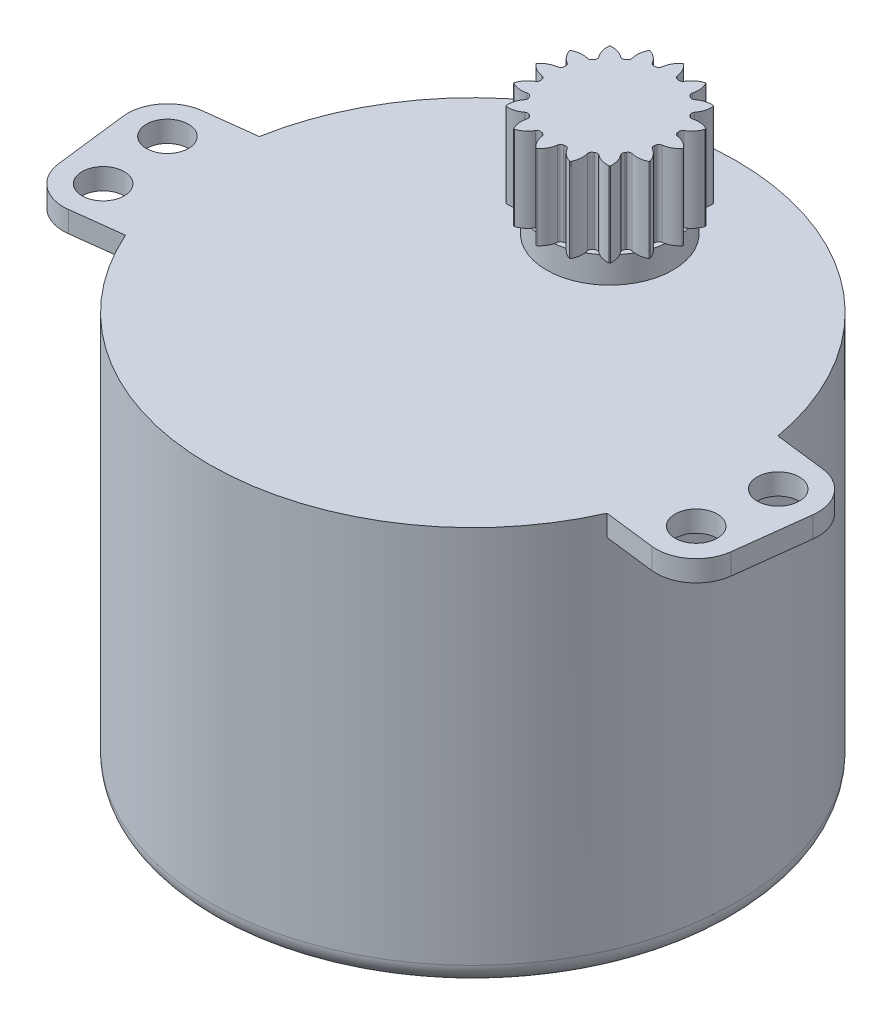
from build123d import *

# Parameters (mm, degrees)
SKETCH1_R           = 25
BOSS_EXTRUDE1_DEPTH = 38
FILLET1_R           = 2
SKETCH2_R           = 6
BOSS_EXTRUDE2_DEPTH = 2.5
SKETCH3_R           = 7
BOSS_EXTRUDE3_DEPTH = 8
CUT_EXTRUDE1_START  = -8
SKETCH4_R           = 7
CUT_EXTRUDE1_DEPTH  = 8
BOSS_EXTRUDE4_START = -2
SKETCH5_R           = 2
BOSS_EXTRUDE4_DEPTH = 2
SKETCH6_W           = 10
SKETCH6_H           = 4
CUT_EXTRUDE2_DEPTH  = 4


with BuildPart() as part:
    # Sketch1 → Boss-Extrude1 (new body)
    with BuildSketch(Plane(origin=(0, 0, 0), x_dir=(1, 0, 0), z_dir=(0, 1, 0))):
        with Locations(Location((0, 0, 0), (0, 0, 270))):
            Circle(SKETCH1_R)
    extrude(amount=BOSS_EXTRUDE1_DEPTH)

    # Fillet1
    fillet1_edges = [part.edges().sort_by_distance(p)[0] for p in [
        (0, 0, -25),
    ]]
    fillet(fillet1_edges, radius=FILLET1_R)

    # Sketch2 → Boss-Extrude2 (add)
    with BuildSketch(Plane(origin=(0, 38, 0), x_dir=(1, 0, 0), z_dir=(0, 1, 0))):
        with Locations(Location((0, 13, 0), (0, 0, 270))):
            Circle(SKETCH2_R)
    extrude(amount=BOSS_EXTRUDE2_DEPTH)

    # Sketch3 → Boss-Extrude3 (add)
    with BuildSketch(Plane(origin=(0, 40.5, 0), x_dir=(1, 0, 0), z_dir=(0, 1, 0))):
        with Locations(Location((0, 13, 0), (0, 0, 270))):
            Circle(SKETCH3_R)
    extrude(amount=BOSS_EXTRUDE3_DEPTH)

    # Sketch4 → Cut-Extrude1 (cut)
    with BuildSketch(Plane(origin=(0, 48.5, 0), x_dir=(1, 0, 0), z_dir=(0, 1, 0)).offset(CUT_EXTRUDE1_START)):
        with Locations((0, 13)):
            Circle(SKETCH4_R)
        with BuildLine():
            ThreePointArc((-3.004669154, 17.606730215), (-3.055636282, 17.573082868), (-3.106226652, 17.538871664))
            ThreePointArc((-3.106226652, 17.538871664), (-3.311678517, 17.478294102), (-3.513604037, 17.549751742))
            ThreePointArc((-3.513604037, 17.549751742), (-4.151825306, 17.876614571), (-4.864318373, 17.957356918))
            ThreePointArc((-4.864318373, 17.957356918), (-4.928294617, 17.928294617), (-4.957356918, 17.864318373))
            ThreePointArc((-4.957356918, 17.864318373), (-4.876614571, 17.151825306), (-4.549751742, 16.513604037))
            ThreePointArc((-4.549751742, 16.513604037), (-4.478294102, 16.311678517), (-4.538871664, 16.106226652))
            ThreePointArc((-4.538871664, 16.106226652), (-4.573082868, 16.055636282), (-4.606730215, 16.004669154))
            ThreePointArc((-4.606730215, 16.004669154), (-4.773360958, 15.87007976), (-4.987261468, 15.85882446))
            ThreePointArc((-4.987261468, 15.85882446), (-5.701986025, 15.916569631), (-6.391142546, 15.718506541))
            ThreePointArc((-6.391142546, 15.718506541), (-6.439127227, 15.667173827), (-6.441494643, 15.596945824))
            ThreePointArc((-6.441494643, 15.596945824), (-6.094239148, 14.969586821), (-5.548020565, 14.505032242))
            ThreePointArc((-5.548020565, 14.505032242), (-5.404728764, 14.345823042), (-5.382072108, 14.13282824))
            ThreePointArc((-5.382072108, 14.13282824), (-5.394319042, 14.072996771), (-5.405900862, 14.013033003))
            ThreePointArc((-5.405900862, 14.013033003), (-5.508342464, 13.824921791), (-5.70165355, 13.732667069))
            ThreePointArc((-5.70165355, 13.732667069), (-6.38407106, 13.512503404), (-6.944973201, 13.065788186))
            ThreePointArc((-6.944973201, 13.065788186), (-6.969661087, 13), (-6.944973201, 12.934211814))
            ThreePointArc((-6.944973201, 12.934211814), (-6.38407106, 12.487496596), (-5.70165355, 12.267332931))
            ThreePointArc((-5.70165355, 12.267332931), (-5.508342464, 12.175078209), (-5.405900862, 11.986966997))
            ThreePointArc((-5.405900862, 11.986966997), (-5.394319042, 11.927003229), (-5.382072108, 11.86717176))
            ThreePointArc((-5.382072108, 11.86717176), (-5.404728764, 11.654176958), (-5.548020565, 11.494967758))
            ThreePointArc((-5.548020565, 11.494967758), (-6.094239148, 11.030413179), (-6.441494643, 10.403054176))
            ThreePointArc((-6.441494643, 10.403054176), (-6.439127227, 10.332826173), (-6.391142546, 10.281493459))
            ThreePointArc((-6.391142546, 10.281493459), (-5.701986025, 10.083430369), (-4.987261468, 10.14117554))
            ThreePointArc((-4.987261468, 10.14117554), (-4.773360958, 10.12992024), (-4.606730215, 9.995330846))
            ThreePointArc((-4.606730215, 9.995330846), (-4.573082868, 9.944363718), (-4.538871664, 9.893773348))
            ThreePointArc((-4.538871664, 9.893773348), (-4.478294102, 9.688321483), (-4.549751742, 9.486395963))
            ThreePointArc((-4.549751742, 9.486395963), (-4.876614571, 8.848174694), (-4.957356918, 8.135681627))
            ThreePointArc((-4.957356918, 8.135681627), (-4.928294617, 8.071705383), (-4.864318373, 8.042643082))
            ThreePointArc((-4.864318373, 8.042643082), (-4.151825306, 8.123385429), (-3.513604037, 8.450248258))
            ThreePointArc((-3.513604037, 8.450248258), (-3.311678517, 8.521705898), (-3.106226652, 8.461128336))
            ThreePointArc((-3.106226652, 8.461128336), (-3.055636282, 8.426917132), (-3.004669154, 8.393269785))
            ThreePointArc((-3.004669154, 8.393269785), (-2.87007976, 8.226639042), (-2.85882446, 8.012738532))
            ThreePointArc((-2.85882446, 8.012738532), (-2.916569631, 7.298013975), (-2.718506541, 6.608857454))
            ThreePointArc((-2.718506541, 6.608857454), (-2.667173827, 6.560872773), (-2.596945824, 6.558505357))
            ThreePointArc((-2.596945824, 6.558505357), (-1.969586821, 6.905760852), (-1.505032242, 7.451979435))
            ThreePointArc((-1.505032242, 7.451979435), (-1.345823042, 7.595271236), (-1.13282824, 7.617927892))
            ThreePointArc((-1.13282824, 7.617927892), (-1.072996771, 7.605680958), (-1.013033003, 7.594099138))
            ThreePointArc((-1.013033003, 7.594099138), (-0.824921791, 7.491657536), (-0.732667069, 7.29834645))
            ThreePointArc((-0.732667069, 7.29834645), (-0.512503404, 6.61592894), (-0.065788186, 6.055026799))
            ThreePointArc((-0.065788186, 6.055026799), (0, 6.030338913), (0.065788186, 6.055026799))
            ThreePointArc((0.065788186, 6.055026799), (0.512503404, 6.61592894), (0.732667069, 7.29834645))
            ThreePointArc((0.732667069, 7.29834645), (0.824921791, 7.491657536), (1.013033003, 7.594099138))
            ThreePointArc((1.013033003, 7.594099138), (1.072996771, 7.605680958), (1.13282824, 7.617927892))
            ThreePointArc((1.13282824, 7.617927892), (1.345823042, 7.595271236), (1.505032242, 7.451979435))
            ThreePointArc((1.505032242, 7.451979435), (1.969586821, 6.905760852), (2.596945824, 6.558505357))
            ThreePointArc((2.596945824, 6.558505357), (2.667173827, 6.560872773), (2.718506541, 6.608857454))
            ThreePointArc((2.718506541, 6.608857454), (2.916569631, 7.298013975), (2.85882446, 8.012738532))
            ThreePointArc((2.85882446, 8.012738532), (2.87007976, 8.226639042), (3.004669154, 8.393269785))
            ThreePointArc((3.004669154, 8.393269785), (3.055636282, 8.426917132), (3.106226652, 8.461128336))
            ThreePointArc((3.106226652, 8.461128336), (3.311678517, 8.521705898), (3.513604037, 8.450248258))
            ThreePointArc((3.513604037, 8.450248258), (4.151825306, 8.123385429), (4.864318373, 8.042643082))
            ThreePointArc((4.864318373, 8.042643082), (4.928294617, 8.071705383), (4.957356918, 8.135681627))
            ThreePointArc((4.957356918, 8.135681627), (4.876614571, 8.848174694), (4.549751742, 9.486395963))
            ThreePointArc((4.549751742, 9.486395963), (4.478294102, 9.688321483), (4.538871664, 9.893773348))
            ThreePointArc((4.538871664, 9.893773348), (4.573082868, 9.944363718), (4.606730215, 9.995330846))
            ThreePointArc((4.606730215, 9.995330846), (4.773360958, 10.12992024), (4.987261468, 10.14117554))
            ThreePointArc((4.987261468, 10.14117554), (5.701986025, 10.083430369), (6.391142546, 10.281493459))
            ThreePointArc((6.391142546, 10.281493459), (6.439127227, 10.332826173), (6.441494643, 10.403054176))
            ThreePointArc((6.441494643, 10.403054176), (6.094239148, 11.030413179), (5.548020565, 11.494967758))
            ThreePointArc((5.548020565, 11.494967758), (5.404728764, 11.654176958), (5.382072108, 11.86717176))
            ThreePointArc((5.382072108, 11.86717176), (5.394319042, 11.927003229), (5.405900862, 11.986966997))
            ThreePointArc((5.405900862, 11.986966997), (5.508342464, 12.175078209), (5.70165355, 12.267332931))
            ThreePointArc((5.70165355, 12.267332931), (6.38407106, 12.487496596), (6.944973201, 12.934211814))
            ThreePointArc((6.944973201, 12.934211814), (6.969661087, 13), (6.944973201, 13.065788186))
            ThreePointArc((6.944973201, 13.065788186), (6.38407106, 13.512503404), (5.70165355, 13.732667069))
            ThreePointArc((5.70165355, 13.732667069), (5.508342464, 13.824921791), (5.405900862, 14.013033003))
            ThreePointArc((5.405900862, 14.013033003), (5.394319042, 14.072996771), (5.382072108, 14.13282824))
            ThreePointArc((5.382072108, 14.13282824), (5.404728764, 14.345823042), (5.548020565, 14.505032242))
            ThreePointArc((5.548020565, 14.505032242), (6.094239148, 14.969586821), (6.441494643, 15.596945824))
            ThreePointArc((6.441494643, 15.596945824), (6.439127227, 15.667173827), (6.391142546, 15.718506541))
            ThreePointArc((6.391142546, 15.718506541), (5.701986025, 15.916569631), (4.987261468, 15.85882446))
            ThreePointArc((4.987261468, 15.85882446), (4.773360958, 15.87007976), (4.606730215, 16.004669154))
            ThreePointArc((4.606730215, 16.004669154), (4.573082868, 16.055636282), (4.538871664, 16.106226652))
            ThreePointArc((4.538871664, 16.106226652), (4.478294102, 16.311678517), (4.549751742, 16.513604037))
            ThreePointArc((4.549751742, 16.513604037), (4.876614571, 17.151825306), (4.957356918, 17.864318373))
            ThreePointArc((4.957356918, 17.864318373), (4.928294617, 17.928294617), (4.864318373, 17.957356918))
            ThreePointArc((4.864318373, 17.957356918), (4.151825306, 17.876614571), (3.513604037, 17.549751742))
            ThreePointArc((3.513604037, 17.549751742), (3.311678517, 17.478294102), (3.106226652, 17.538871664))
            ThreePointArc((3.106226652, 17.538871664), (3.055636282, 17.573082868), (3.004669154, 17.606730215))
            ThreePointArc((3.004669154, 17.606730215), (2.87007976, 17.773360958), (2.85882446, 17.987261468))
            ThreePointArc((2.85882446, 17.987261468), (2.916569631, 18.701986025), (2.718506541, 19.391142546))
            ThreePointArc((2.718506541, 19.391142546), (2.667173827, 19.439127227), (2.596945824, 19.441494643))
            ThreePointArc((2.596945824, 19.441494643), (1.969586821, 19.094239148), (1.505032242, 18.548020565))
            ThreePointArc((1.505032242, 18.548020565), (1.345823042, 18.404728764), (1.13282824, 18.382072108))
            ThreePointArc((1.13282824, 18.382072108), (1.072996771, 18.394319042), (1.013033003, 18.405900862))
            ThreePointArc((1.013033003, 18.405900862), (0.824921791, 18.508342464), (0.732667069, 18.70165355))
            ThreePointArc((0.732667069, 18.70165355), (0.512503404, 19.38407106), (0.065788186, 19.944973201))
            ThreePointArc((0.065788186, 19.944973201), (0, 19.969661087), (-0.065788186, 19.944973201))
            ThreePointArc((-0.065788186, 19.944973201), (-0.512503404, 19.38407106), (-0.732667069, 18.70165355))
            ThreePointArc((-0.732667069, 18.70165355), (-0.824921791, 18.508342464), (-1.013033003, 18.405900862))
            ThreePointArc((-1.013033003, 18.405900862), (-1.072996771, 18.394319042), (-1.13282824, 18.382072108))
            ThreePointArc((-1.13282824, 18.382072108), (-1.345823042, 18.404728764), (-1.505032242, 18.548020565))
            ThreePointArc((-1.505032242, 18.548020565), (-1.969586821, 19.094239148), (-2.596945824, 19.441494643))
            ThreePointArc((-2.596945824, 19.441494643), (-2.667173827, 19.439127227), (-2.718506541, 19.391142546))
            ThreePointArc((-2.718506541, 19.391142546), (-2.916569631, 18.701986025), (-2.85882446, 17.987261468))
            ThreePointArc((-2.85882446, 17.987261468), (-2.87007976, 17.773360958), (-3.004669154, 17.606730215))
        make_face(mode=Mode.SUBTRACT)
    extrude(amount=CUT_EXTRUDE1_DEPTH, mode=Mode.SUBTRACT)

    # Sketch5 → Boss-Extrude4 (add)
    # profile 1 of 2: a face of its own
    with BuildSketch(Plane(origin=(0, 38, 0), x_dir=(1, 0, 0), z_dir=(0, 1, 0)).offset(BOSS_EXTRUDE4_START)):
        with BuildLine():
            Line((-32.760329016, -0.457174627), (-31.91550143, -7.406006641))
            ThreePointArc((-31.91550143, -7.406006641), (-30.490855282, -9.93105744), (-27.697997786, -10.70916103))
            Line((-27.697997786, -10.70916103), (-22.859719044, -10.120931045))
            ThreePointArc((-22.859719044, -10.120931045), (-24.81725719, -3.017241379), (-24.618895885, 4.348559001))
            Line((-24.618895885, 4.348559001), (-29.457174627, 3.760329016))
            ThreePointArc((-29.457174627, 3.760329016), (-31.982225426, 2.335682868), (-32.760329016, -0.457174627))
        make_face()
        with Locations(Location((-29, 0, 0), (0, 0, 270))):
            Circle(SKETCH5_R, mode=Mode.SUBTRACT)
        with Locations(Location((-28.155172414, -6.948832013, 0), (0, 0, 270))):
            Circle(SKETCH5_R, mode=Mode.SUBTRACT)
    # profile 2 of 2: a face of its own
    with BuildSketch(Plane(origin=(0, 38, 0), x_dir=(1, 0, 0), z_dir=(0, 1, 0)).offset(BOSS_EXTRUDE4_START)):
        with BuildLine():
            Line((29.457174627, 3.760329016), (24.618895885, 4.348559001))
            ThreePointArc((24.618895885, 4.348559001), (24.81725719, -3.017241379), (22.859719044, -10.120931045))
            Line((22.859719044, -10.120931045), (27.697997786, -10.70916103))
            ThreePointArc((27.697997786, -10.70916103), (30.490855282, -9.93105744), (31.91550143, -7.406006641))
            Line((31.91550143, -7.406006641), (32.760329016, -0.457174627))
            ThreePointArc((32.760329016, -0.457174627), (31.982225426, 2.335682868), (29.457174627, 3.760329016))
        make_face()
        with Locations(Location((29, 0, 0), (0, 0, 90))):
            Circle(SKETCH5_R, mode=Mode.SUBTRACT)
        with Locations(Location((28.155172414, -6.948832013, 0), (0, 0, 90))):
            Circle(SKETCH5_R, mode=Mode.SUBTRACT)
    extrude(amount=BOSS_EXTRUDE4_DEPTH)

    # Sketch6 → Cut-Extrude2 (cut)
    with BuildSketch(Plane.XZ):
        Rectangle(SKETCH6_W, SKETCH6_H)
    extrude(amount=-CUT_EXTRUDE2_DEPTH, mode=Mode.SUBTRACT)


solid = part.part
